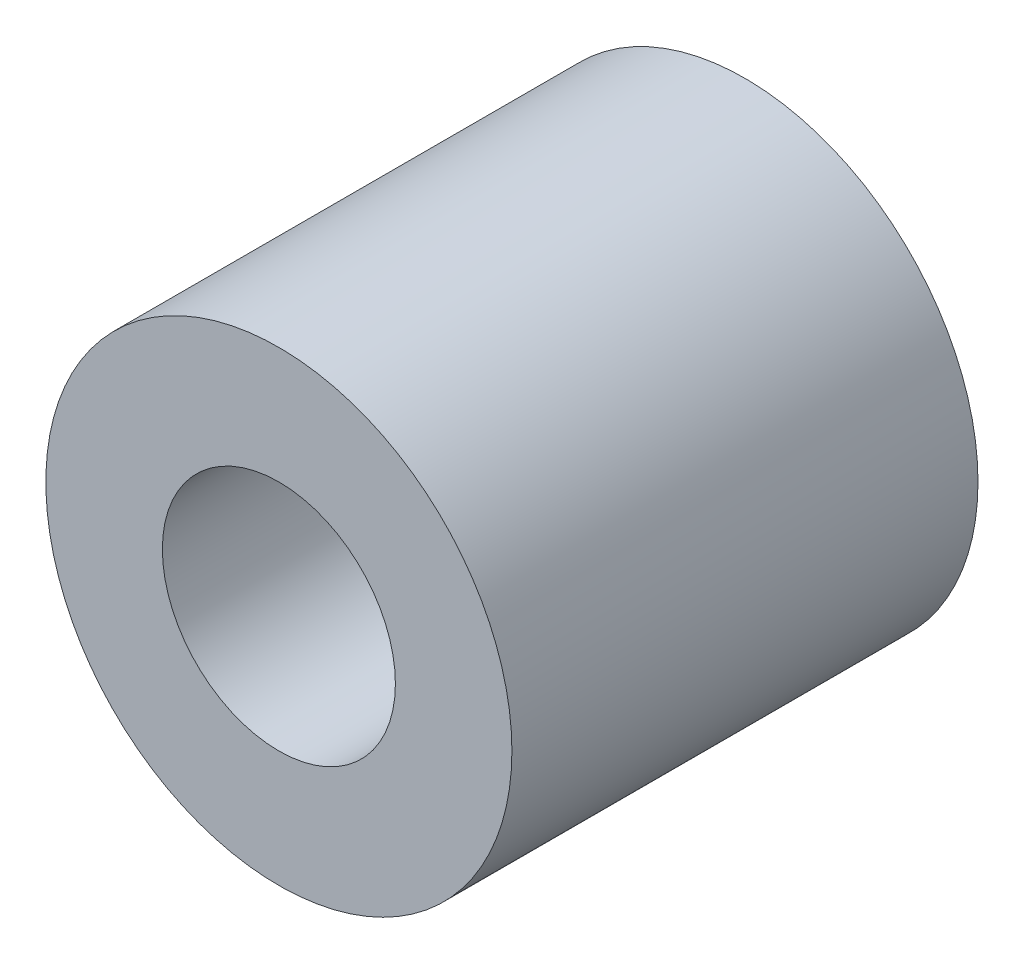
from build123d import *

# Parameters (mm, degrees)
SKETCH_1_R      = 20
SKETCH_1_R_2    = 10
EXTRUDE_3_DEPTH = 40


with BuildPart() as part:
    # 스케치1 → 보스-돌출3 (new body)
    with BuildSketch(Plane.XY):
        Circle(SKETCH_1_R)
        Circle(SKETCH_1_R_2, mode=Mode.SUBTRACT)
    extrude(amount=EXTRUDE_3_DEPTH)


solid = part.part
